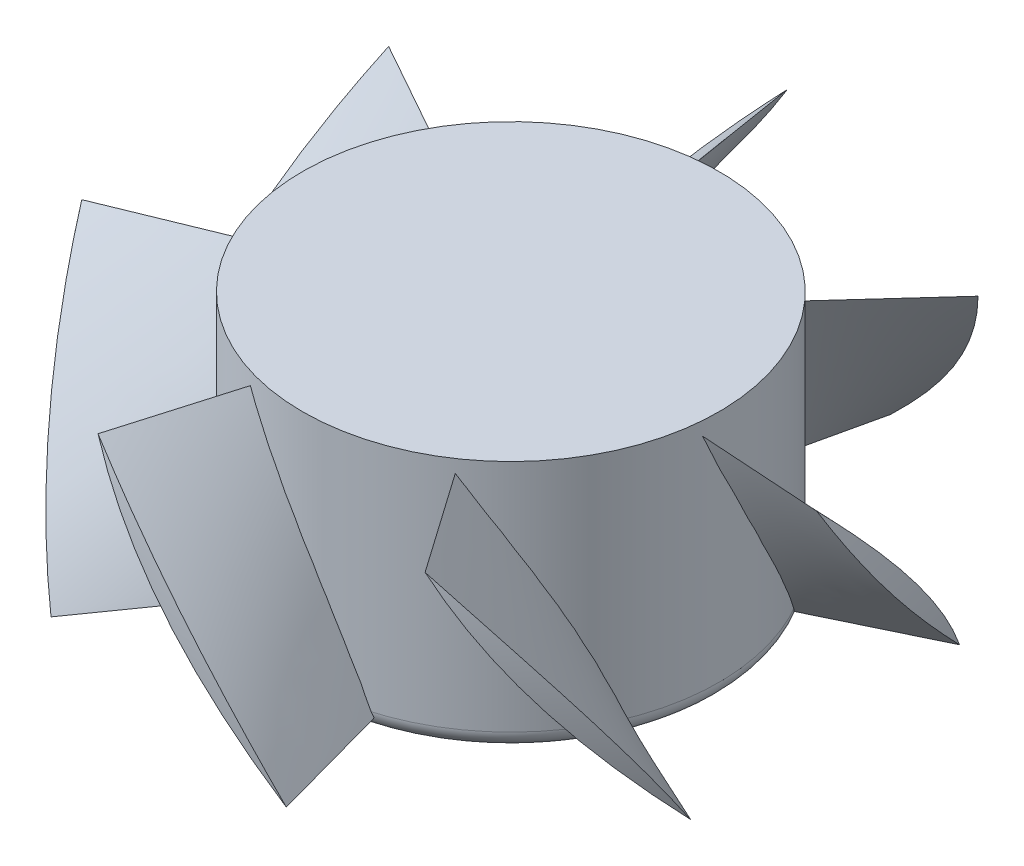
from build123d import *

# Parameters (mm, degrees)
ESTRUSIONE_ESTRUSIONE1_DEPTH      = 9
ESTRUSIONE_ESTRUSIONE1_DEPTH_BACK = 12.2
SCHIZZO1_R                        = 17.5
TAGLIO_ESTRUSIONE2_DEPTH          = 25
RIPETIZIONECIRCOLARE7_COUNT       = 7
RACCORDO1_R                       = 1.5


with BuildPart() as part:
    # Schizzo1 → Estrusione-Estrusione1 (new, two sides: drawn at the far end of the back side and taken through both)
    with BuildSketch(Plane(origin=(0, 0, 0), x_dir=(-1, 0, 0), z_dir=(0, 1, 0)).offset(-ESTRUSIONE_ESTRUSIONE1_DEPTH_BACK)):
        with Locations(Location((0, 0, 0), (0, 0, 90))):
            Circle(SCHIZZO1_R)
    extrude(amount=ESTRUSIONE_ESTRUSIONE1_DEPTH + ESTRUSIONE_ESTRUSIONE1_DEPTH_BACK)

    # Raccordo1
    raccordo1_edges = [part.edges().sort_by_distance(p)[0] for p in [
        (0, -12.2, -17.5),
    ]]
    fillet(raccordo1_edges, radius=RACCORDO1_R)


with BuildPart() as body_2:
    # Schizzo5 → Loft1 section 0
    with BuildSketch(Plane.XY.offset(29)):
        with BuildLine():
            add(Edge.make_bspline(
                [(-8.837174774, 7.876988884), (0.685799365, -0.944345589), (8.372212253, -11.393982528)],
                knots=[0, 0, 0, 1, 1, 1], degree=2))
            add(Edge.make_bspline(
                [(-8.837174774, 7.876988884), (-1.725418533, -3.069366959), (8.372212253, -11.393982528)],
                knots=[0, 0, 0, 1, 1, 1], degree=2))
        make_face()
    # Schizzo4 → Loft1 section 1
    with BuildSketch(Plane.XY.offset(16)):
        with BuildLine():
            add(Edge.make_bspline(
                [(-5, 7.9), (-0.519489973, -1.87234341), (5, -11.1)],
                knots=[0, 0, 0, 1, 1, 1], degree=2))
            add(Edge.make_bspline(
                [(-5, 7.9), (1.335439673, -0.881249612), (5, -11.1)],
                knots=[0, 0, 0, 1, 1, 1], degree=2))
        make_face()
    loft()

    # Schizzo9 → Taglio-Estrusione2 (cut)
    with BuildSketch(Plane(origin=(12, 0, 0), x_dir=(0, 0, -1), z_dir=(1, 0, 0))):
        with BuildLine():
            Line((-29.114875703, 9.137740098), (-26.314875703, 9.137740098))
            ThreePointArc((-26.314875703, 9.137740098), (-27.527453372, -1.862259902), (-26.314875703, -12.862259902))
            Line((-26.314875703, -12.862259902), (-29.114875703, -12.862259902))
            Line((-29.114875703, -12.862259902), (-29.114875703, 9.137740098))
        make_face()
    extrude(amount=-TAGLIO_ESTRUSIONE2_DEPTH, mode=Mode.SUBTRACT)


with BuildPart() as ripetizionecircolare7_1:
    # RipetizioneCircolare7: pattern copy
    add(body_2.part.rotate(Axis((0, 9, 0), (0, 1, 0)), 1 * 360 / RIPETIZIONECIRCOLARE7_COUNT))


with BuildPart() as ripetizionecircolare7_2:
    # RipetizioneCircolare7: pattern copy
    add(body_2.part.rotate(Axis((0, 9, 0), (0, 1, 0)), 2 * 360 / RIPETIZIONECIRCOLARE7_COUNT))


with BuildPart() as ripetizionecircolare7_3:
    # RipetizioneCircolare7: pattern copy
    add(body_2.part.rotate(Axis((0, 9, 0), (0, 1, 0)), 3 * 360 / RIPETIZIONECIRCOLARE7_COUNT))


with BuildPart() as ripetizionecircolare7_4:
    # RipetizioneCircolare7: pattern copy
    add(body_2.part.rotate(Axis((0, 9, 0), (0, 1, 0)), 4 * 360 / RIPETIZIONECIRCOLARE7_COUNT))


with BuildPart() as ripetizionecircolare7_5:
    # RipetizioneCircolare7: pattern copy
    add(body_2.part.rotate(Axis((0, 9, 0), (0, 1, 0)), 5 * 360 / RIPETIZIONECIRCOLARE7_COUNT))


with BuildPart() as ripetizionecircolare7_6:
    # RipetizioneCircolare7: pattern copy
    add(body_2.part.rotate(Axis((0, 9, 0), (0, 1, 0)), 6 * 360 / RIPETIZIONECIRCOLARE7_COUNT))


solid = Compound([part.part, body_2.part, ripetizionecircolare7_1.part, ripetizionecircolare7_2.part, ripetizionecircolare7_3.part, ripetizionecircolare7_4.part, ripetizionecircolare7_5.part, ripetizionecircolare7_6.part])
